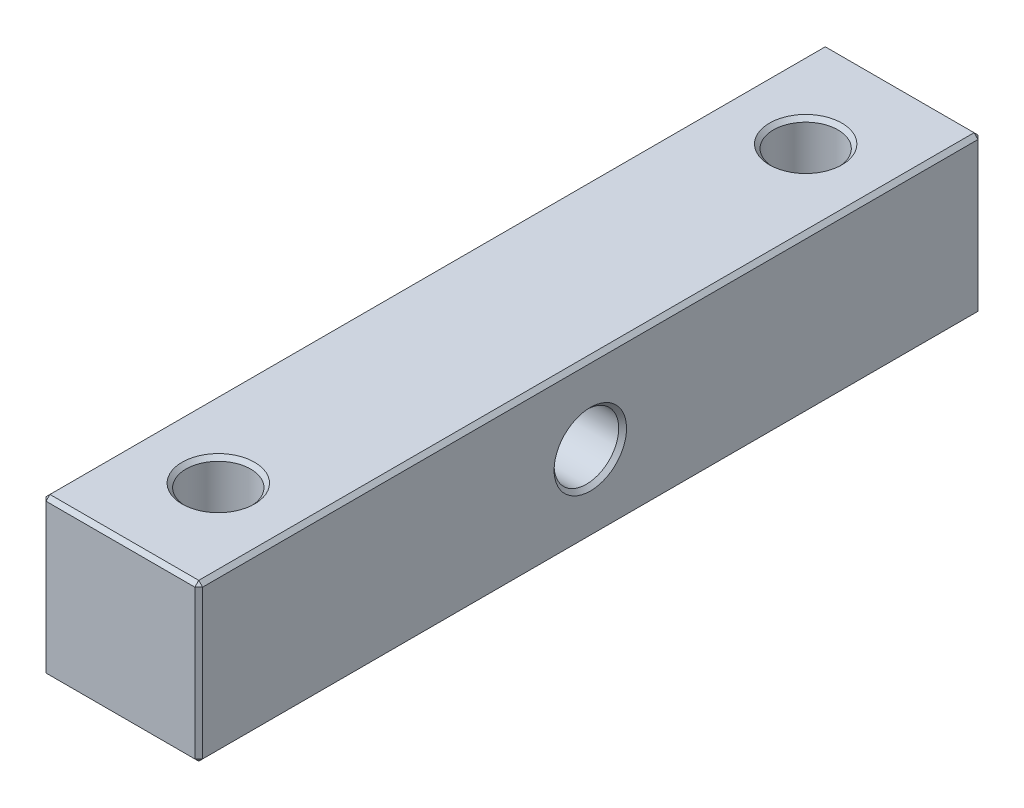
from build123d import *

# Parameters (mm, degrees)
SKETCH_1_W         = 8
SKETCH_1_H         = 8
EXTRUDE_1_DEPTH    = 20
HOLE_WIZARD_M4_1_D = 3.3
HOLE_WIZARD_M4_2_D = 3.3
CHAMFER_1_SIZE     = 0.2


with BuildPart() as part:
    # 草图1 → 凸台-拉伸1 (new, symmetric)
    with BuildSketch(Plane.XY):
        Rectangle(SKETCH_1_W, SKETCH_1_H)
    extrude(amount=EXTRUDE_1_DEPTH, both=True)

    # M4 螺纹孔1 (through all)
    with Locations(Plane(origin=(4, 0, 0), x_dir=(0, 0, -1), z_dir=(1, 0, 0))):
        with Locations((0, 0)):
            Hole(HOLE_WIZARD_M4_1_D / 2)

    # M4 螺纹孔2 (through all)
    with Locations(Plane(origin=(0, 4, 0), x_dir=(1, 0, 0), z_dir=(0, 1, 0))):
        with Locations((0, -15), (0, 15)):
            Hole(HOLE_WIZARD_M4_2_D / 2)

    # 倒角1
    chamfer_1_edges = [part.edges().sort_by_distance(p)[0] for p in [
        (-4, 0, 20),
        (4, 0, -1.65),
        (-4, 0, -1.65),
        (0, -4, 20),
        (1.65, 4, -15),
        (1.65, -4, -15),
        (1.65, 4, 15),
        (1.65, -4, 15),
        (4, 0, 20),
        (0, -4, -20),
        (-4, 0, -20),
        (0, 4, -20),
        (4, 0, -20),
        (4, -4, 0),
        (-4, -4, 0),
        (-4, 4, 0),
        (4, 4, 0),
        (0, 4, 20),
    ]]
    chamfer(chamfer_1_edges, length=CHAMFER_1_SIZE)


solid = part.part
